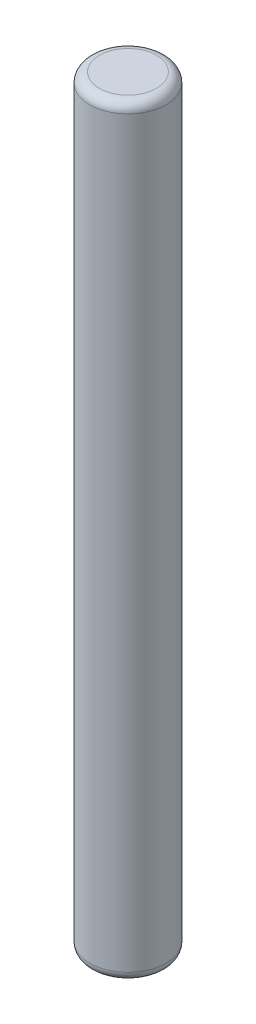
from build123d import *

# Parameters (mm, degrees)
SKETCH_1_R      = 2
EXTRUDE_1_DEPTH = 40
FILLET_1_R      = 0.5


with BuildPart() as part:
    # 草图1 → 凸台-拉伸1 (new body)
    with BuildSketch(Plane(origin=(0, 0, 0), x_dir=(1, 0, 0), z_dir=(0, 1, 0))):
        with Locations(Location((0, 0, 0), (0, 0, 270))):
            Circle(SKETCH_1_R)
    extrude(amount=EXTRUDE_1_DEPTH)

    # 圆角1
    fillet_1_edges = [part.edges().sort_by_distance(p)[0] for p in [
        (0, 0, -2),
        (0, 40, -2),
    ]]
    fillet(fillet_1_edges, radius=FILLET_1_R)


solid = part.part
